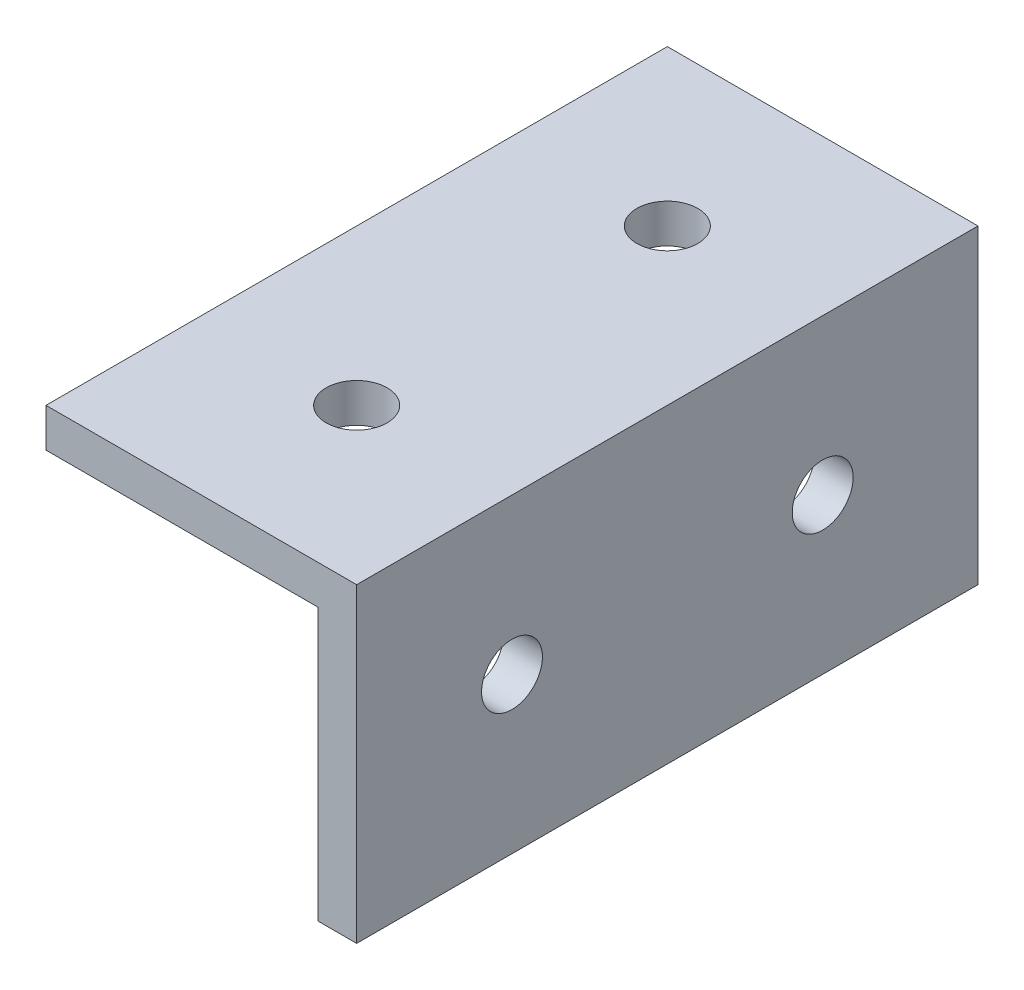
from build123d import *

# Parameters (mm, degrees)
BOSS_EXTRUDE1_DEPTH        = 50.8
F_9_0_196_DIAMETER_HOLE1_D = 4.9784
F_9_0_196_DIAMETER_HOLE2_D = 4.9784


with BuildPart() as part:
    # Sketch1 → Boss-Extrude1 (new body)
    with BuildSketch(Plane(origin=(0, 0, 0), x_dir=(0, 1, 0), z_dir=(0, 0, 1))):
        Polygon((12.7, 12.7), (12.7, -12.7), (-12.7, -12.7), (-12.7, -9.525), (9.525, -9.525), (9.525, 12.7), align=None)
    extrude(amount=BOSS_EXTRUDE1_DEPTH)

    # #9 (0.196) Diameter Hole1 (through all)
    with Locations(Plane(origin=(0, 12.7, 0), x_dir=(-1, 0, 0), z_dir=(0, 1, 0))):
        with Locations((0, 38.1), (0, 12.7)):
            Hole(F_9_0_196_DIAMETER_HOLE1_D / 2)

    # #9 (0.196) Diameter Hole2 (through all)
    with Locations(Plane.YZ.offset(12.7)):
        with Locations((0, 38.1), (0, 12.7)):
            Hole(F_9_0_196_DIAMETER_HOLE2_D / 2)


solid = part.part
